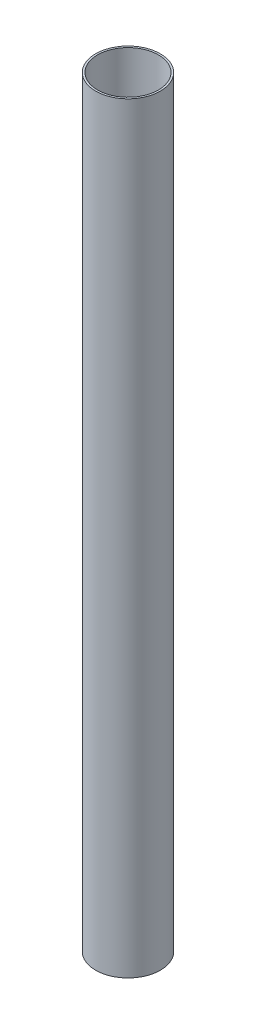
from build123d import *

# Parameters (mm, degrees)
SKETCH_1_R      = 8.5
SKETCH_1_R_2    = 8
EXTRUDE_1_DEPTH = 200


with BuildPart() as part:
    # 草图1 → 凸台-拉伸1 (new body)
    with BuildSketch(Plane(origin=(0, 0, 0), x_dir=(1, 0, 0), z_dir=(0, 1, 0))):
        with Locations(Location((0, 0, 0), (0, 0, 270))):
            Circle(SKETCH_1_R)
        with Locations(Location((0, 0, 0), (0, 0, 270))):
            Circle(SKETCH_1_R_2, mode=Mode.SUBTRACT)
    extrude(amount=EXTRUDE_1_DEPTH)


solid = part.part
